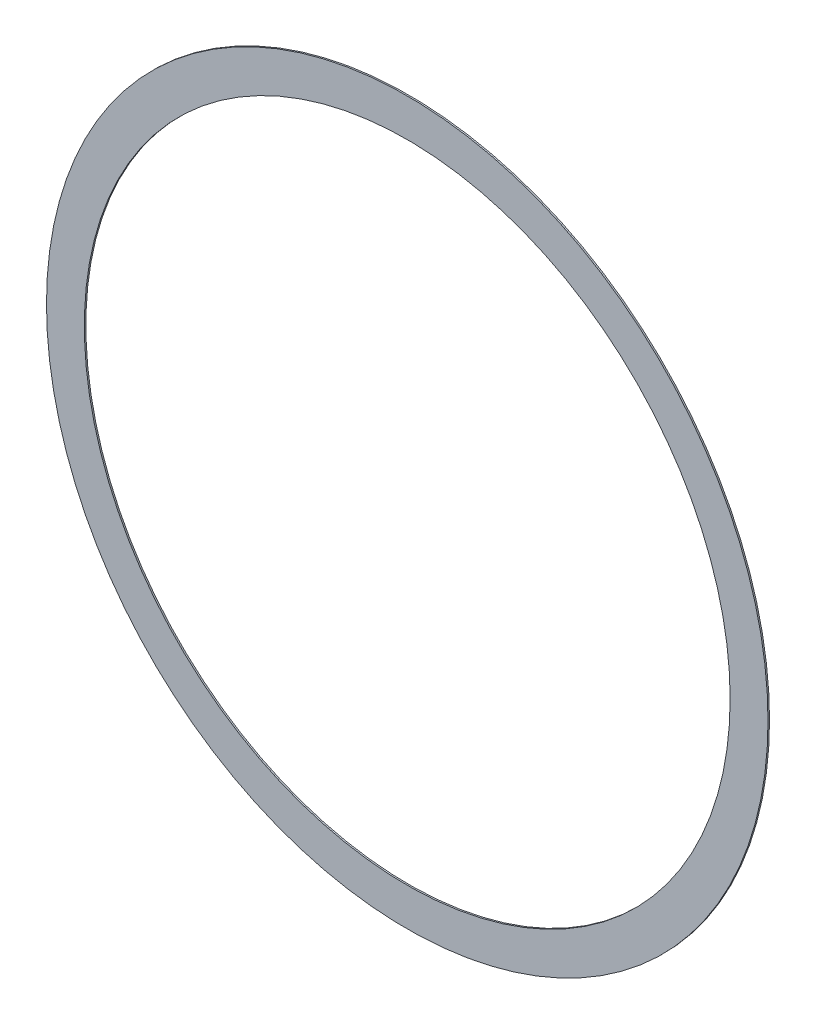
from build123d import *

# Parameters (mm, degrees)
SKETCH1_R           = 476.5
SKETCH1_R_2         = 426.5
BOSS_EXTRUDE1_DEPTH = 2


with BuildPart() as part:
    # Sketch1 → Boss-Extrude1 (new body)
    with BuildSketch(Plane.XY):
        Circle(SKETCH1_R)
        Circle(SKETCH1_R_2, mode=Mode.SUBTRACT)
    extrude(amount=BOSS_EXTRUDE1_DEPTH)


solid = part.part
